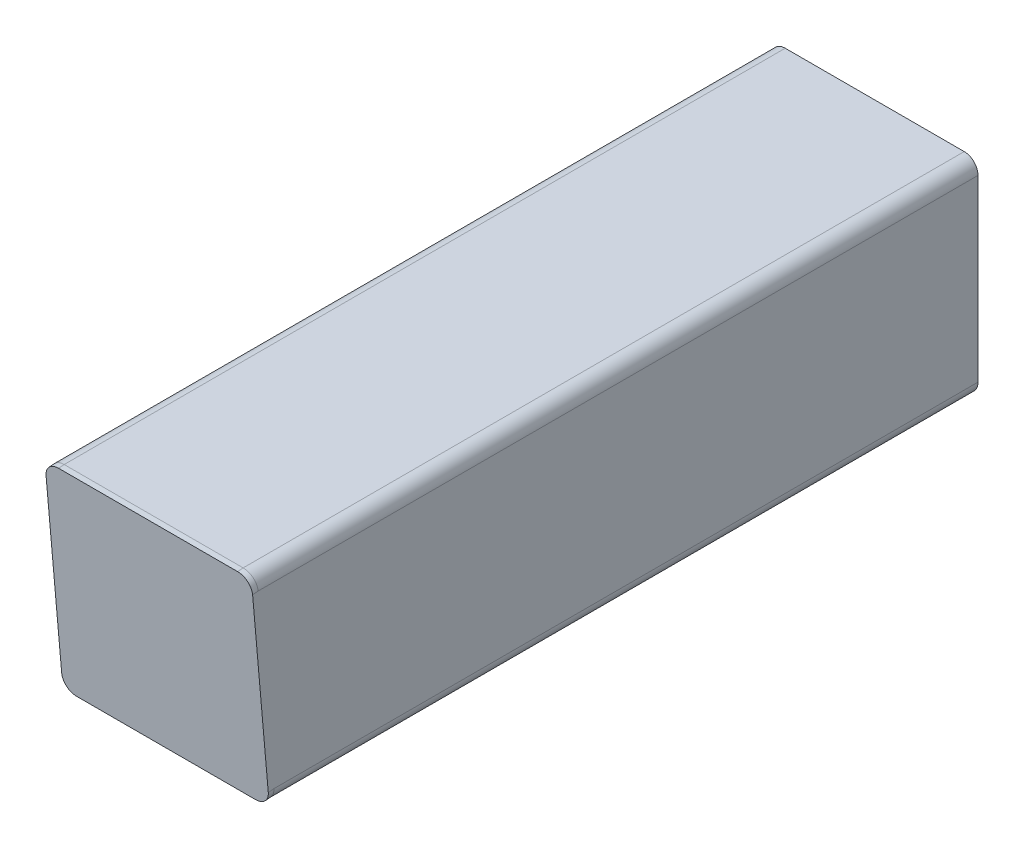
from build123d import *

# Parameters (mm, degrees)
BOSS_EXTRUDE1_DEPTH = 133
CUT_EXTRUDE1_DEPTH  = 144.49989547
BOSS_EXTRUDE2_DEPTH = 1.022167739


with BuildPart() as part:
    # Sketch1 → Boss-Extrude1 (new body)
    with BuildSketch(Plane.XY):
        with BuildLine():
            Line((2.54, 0), (35.56, 0))
            ThreePointArc((35.56, 0), (37.356051224, -0.743948776), (38.1, -2.54))
            Line((38.1, -2.54), (38.1, -35.56))
            ThreePointArc((38.1, -35.56), (37.356051224, -37.356051224), (35.56, -38.1))
            Line((35.56, -38.1), (2.54, -38.1))
            ThreePointArc((2.54, -38.1), (0.743948776, -37.356051224), (0, -35.56))
            Line((0, -35.56), (0, -2.54))
            ThreePointArc((0, -2.54), (0.743948776, -0.743948776), (2.54, 0))
        make_face()
        with BuildLine():
            Line((5.3086, -2.7686), (32.7914, -2.7686))
            ThreePointArc((32.7914, -2.7686), (34.587451224, -3.512548776), (35.3314, -5.3086))
            Line((35.3314, -5.3086), (35.3314, -32.7914))
            ThreePointArc((35.3314, -32.7914), (34.587451224, -34.587451224), (32.7914, -35.3314))
            Line((32.7914, -35.3314), (5.3086, -35.3314))
            ThreePointArc((5.3086, -35.3314), (3.512548776, -34.587451224), (2.7686, -32.7914))
            Line((2.7686, -32.7914), (2.7686, -5.3086))
            ThreePointArc((2.7686, -5.3086), (3.512548776, -3.512548776), (5.3086, -2.7686))
        make_face(mode=Mode.SUBTRACT)
    extrude(amount=BOSS_EXTRUDE1_DEPTH)

    # Sketch2 → Cut-Extrude1 (cut, through all)
    with BuildSketch(Plane(origin=(38.1, 0, 0), x_dir=(0, 0, -1), z_dir=(1, 0, 0))):
        Polygon((-133, 0), (-129.66668192, -38.1), (-133, -38.1), align=None)
    extrude(amount=-CUT_EXTRUDE1_DEPTH, mode=Mode.SUBTRACT)

    # Sketch3 → Boss-Extrude2 (add)
    with BuildSketch(Plane(origin=(0, -11.547603815, 131.989715575), x_dir=(1, 0, 0), z_dir=(0, -0.08715574274765185, 0.9961946980917462))):
        with BuildLine():
            Line((2.54, -26.653822025), (35.56, -26.653822025))
            add(Edge.make_bspline(
                [(35.56, -26.653822025), (38.1, -26.653822025), (38.1, -24.104119638)],
                knots=[0, 0, 0, 1.570796327, 1.570796327, 1.570796327], degree=2, weights=[1, 0.707106781, 1]))
            Line((38.1, -24.104119638), (38.1, 9.042011398))
            add(Edge.make_bspline(
                [(38.1, 9.042011398), (38.1, 11.591713785), (35.56, 11.591713785)],
                knots=[1.570796327, 1.570796327, 1.570796327, 3.141592654, 3.141592654, 3.141592654], degree=2, weights=[1, 0.707106781, 1]))
            Line((35.56, 11.591713785), (2.54, 11.591713785))
            add(Edge.make_bspline(
                [(2.54, 11.591713785), (0, 11.591713785), (0, 9.042011398)],
                knots=[0, 0, 0, 1.570796327, 1.570796327, 1.570796327], degree=2, weights=[1, 0.707106781, 1]))
            Line((0, 9.042011398), (0, -24.104119638))
            add(Edge.make_bspline(
                [(0, -24.104119638), (0, -26.653822025), (2.54, -26.653822025)],
                knots=[4.71238898, 4.71238898, 4.71238898, 6.283185307, 6.283185307, 6.283185307], degree=2, weights=[1, 0.707106781, 1]))
        make_face()
    extrude(amount=BOSS_EXTRUDE2_DEPTH)


solid = part.part
